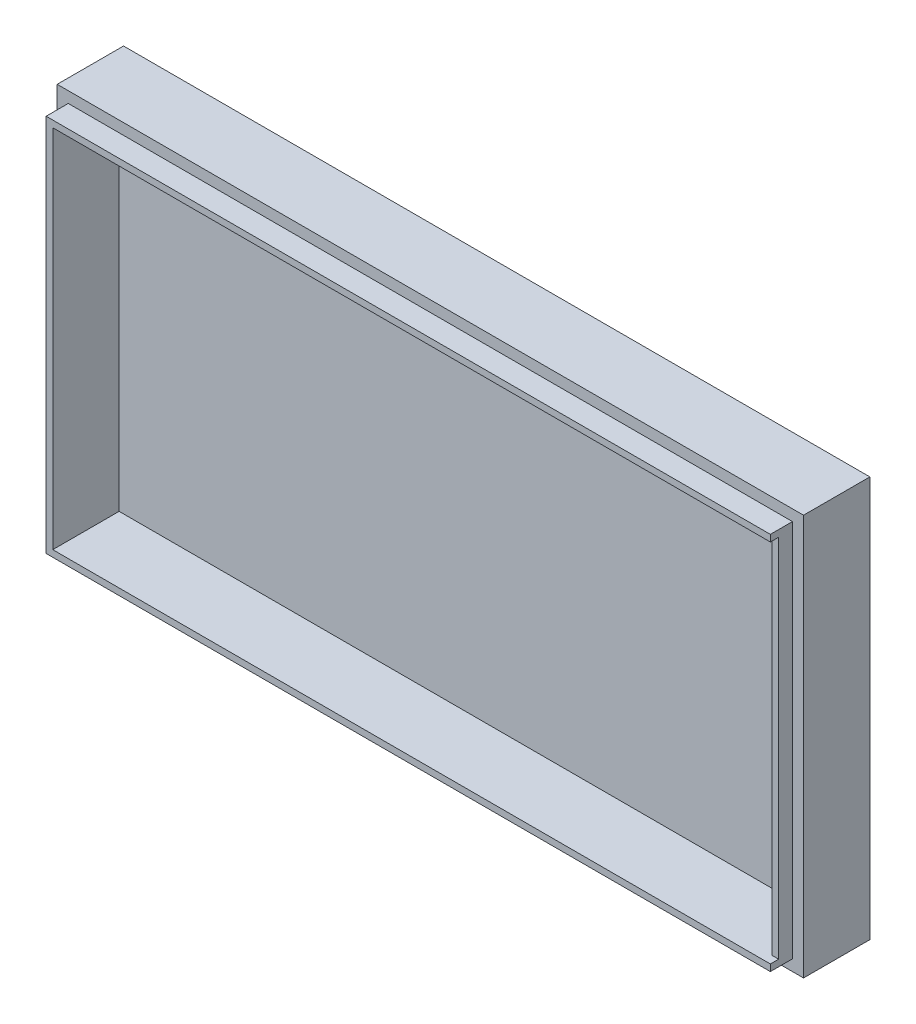
from build123d import *

# Parameters (mm, degrees)
SKETCH1_W           = 135
SKETCH1_H           = 72.5
BOSS_EXTRUDE1_DEPTH = 12
SKETCH2_W           = 131
SKETCH2_H           = 68.5
BOSS_EXTRUDE2_DEPTH = 4
SKETCH4_W           = 128.6
SKETCH4_H           = 66.1
CUT_EXTRUDE1_DEPTH  = 4
SKETCH5_W           = 128.6
SKETCH5_H           = 66.1
CUT_EXTRUDE2_DEPTH  = 8
SKETCH6_W           = 1.5
SKETCH6_H           = 66.1
CUT_EXTRUDE3_DEPTH  = 10


with BuildPart() as part:
    # Sketch1 → Boss-Extrude1 (new body)
    with BuildSketch(Plane.XY):
        with Locations((62.683098592, -32.088028169)):
            Rectangle(SKETCH1_W, SKETCH1_H)
    extrude(amount=BOSS_EXTRUDE1_DEPTH)

    # Sketch2 → Boss-Extrude2 (add)
    with BuildSketch(Plane.XY.offset(12)):
        with Locations((62.683098592, -32.088028169)):
            Rectangle(SKETCH2_W, SKETCH2_H)
    extrude(amount=BOSS_EXTRUDE2_DEPTH)

    # Sketch4 → Cut-Extrude1 (cut)
    with BuildSketch(Plane.XY.offset(16)):
        with Locations((62.683098592, -32.088028169)):
            Rectangle(SKETCH4_W, SKETCH4_H)
    extrude(amount=-CUT_EXTRUDE1_DEPTH, mode=Mode.SUBTRACT)

    # Sketch5 → Cut-Extrude2 (cut)
    with BuildSketch(Plane.XY.offset(12)):
        with Locations((62.683098592, -32.088028169)):
            Rectangle(SKETCH5_W, SKETCH5_H)
    extrude(amount=-CUT_EXTRUDE2_DEPTH, mode=Mode.SUBTRACT)

    # Sketch6 → Cut-Extrude3 (cut)
    with BuildSketch(Plane(origin=(128.183098592, 0, 0), x_dir=(0, 0, -1), z_dir=(1, 0, 0))):
        with Locations((-15.25, -32.088028169)):
            Rectangle(SKETCH6_W, SKETCH6_H)
    extrude(amount=-CUT_EXTRUDE3_DEPTH, mode=Mode.SUBTRACT)


solid = part.part
